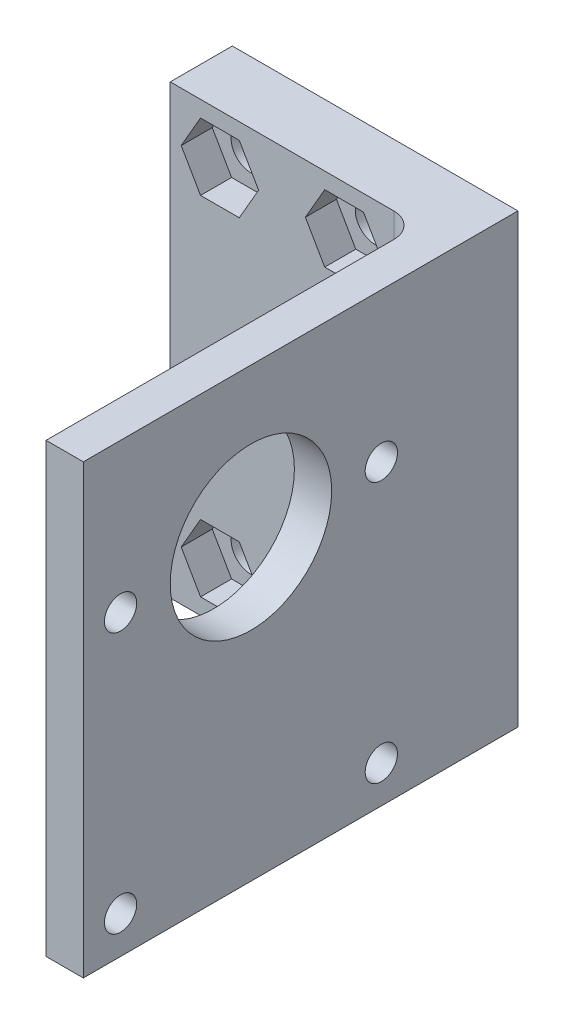
from build123d import *

# Parameters (mm, degrees)
SKETCH_2_W          = 35
SKETCH_2_H          = 36
SKETCH_2_R          = 1.3
SKETCH_2_R_2        = 6.5
EXTRUDE_1_DEPTH     = 3
SKETCH_4_W          = 5
SKETCH_4_H          = 36
EXTRUDE_2_DEPTH     = 20
FILLET_1_R          = 2
CUT_EXTRUDE_1_DEPTH = 2.5
SKETCH_7_R          = 1.6
CUT_EXTRUDE_2_DEPTH = 10


with BuildPart() as part:
    # ｽｹｯﾁ2 → ﾎﾞｽ - 押し出し1 (new body)
    with BuildSketch(Plane(origin=(0, 0, 0), x_dir=(0, 0, -1), z_dir=(1, 0, 0))):
        Rectangle(SKETCH_2_W, SKETCH_2_H)
        with Locations((-14.5, 6)):
            Circle(SKETCH_2_R, mode=Mode.SUBTRACT)
        with Locations((6.5, 6)):
            Circle(SKETCH_2_R, mode=Mode.SUBTRACT)
        with Locations((-14.5, -15)):
            Circle(SKETCH_2_R, mode=Mode.SUBTRACT)
        with Locations((6.5, -15)):
            Circle(SKETCH_2_R, mode=Mode.SUBTRACT)
        with Locations((-4, 6)):
            Circle(SKETCH_2_R_2, mode=Mode.SUBTRACT)
    extrude(amount=EXTRUDE_1_DEPTH)

    # ｽｹｯﾁ4 → ﾎﾞｽ - 押し出し2 (add)
    with BuildSketch(Plane.ZY):
        with Locations((-15, 0)):
            Rectangle(SKETCH_4_W, SKETCH_4_H)
    extrude(amount=EXTRUDE_2_DEPTH)

    # ﾌｨﾚｯﾄ1
    fillet_1_edges = [part.edges().sort_by_distance(p)[0] for p in [
        (0, 0, -12.5),
    ]]
    fillet(fillet_1_edges, radius=FILLET_1_R)

    # ｽｹｯﾁ5 → ｶｯﾄ - 押し出し1 (cut)
    with BuildSketch(Plane.XY.offset(-12.5)):
        Polygon((-12.882308546, 14), (-14.441154273, 16.7), (-17.558845727, 16.7), (-19.117691454, 14), (-17.558845727, 11.3), (-14.441154273, 11.3), align=None)
        Polygon((-2.882308546, 14), (-4.441154273, 16.7), (-7.558845727, 16.7), (-9.117691454, 14), (-7.558845727, 11.3), (-4.441154273, 11.3), align=None)
        Polygon((-12.882308546, -14), (-14.441154273, -11.3), (-17.558845727, -11.3), (-19.117691454, -14), (-17.558845727, -16.7), (-14.441154273, -16.7), align=None)
        Polygon((-2.882308546, -14), (-4.441154273, -11.3), (-7.558845727, -11.3), (-9.117691454, -14), (-7.558845727, -16.7), (-4.441154273, -16.7), align=None)
    extrude(amount=-CUT_EXTRUDE_1_DEPTH, mode=Mode.SUBTRACT)

    # ｽｹｯﾁ7 → ｶｯﾄ - 押し出し2 (cut)
    with BuildSketch(Plane.XY.offset(-15)):
        with Locations((-16, 14)):
            Circle(SKETCH_7_R)
        with Locations((-6, 14)):
            Circle(SKETCH_7_R)
        with Locations((-16, -14)):
            Circle(SKETCH_7_R)
        with Locations((-6, -14)):
            Circle(SKETCH_7_R)
    extrude(amount=-CUT_EXTRUDE_2_DEPTH, mode=Mode.SUBTRACT)


solid = part.part
